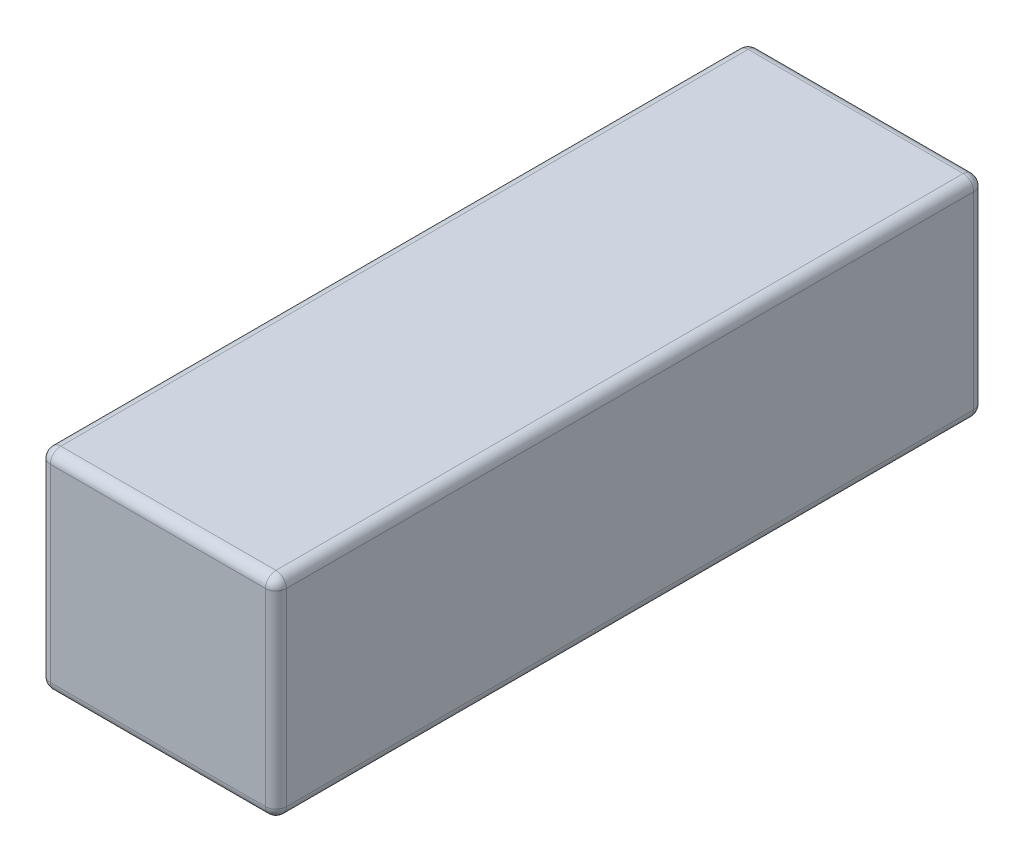
from build123d import *

# Parameters (mm, degrees)
SKETCH1_W           = 45
SKETCH1_H           = 40
BOSS_EXTRUDE1_DEPTH = 135
FILLET1_R           = 2


with BuildPart() as part:
    # Sketch1 → Boss-Extrude1 (new body)
    with BuildSketch(Plane.XY):
        Rectangle(SKETCH1_W, SKETCH1_H)
    extrude(amount=BOSS_EXTRUDE1_DEPTH)

    # Fillet1
    fillet1_edges = [part.edges().sort_by_distance(p)[0] for p in [
        (-22.5, 0, 135),
        (0, -20, 135),
        (22.5, 0, 135),
        (0, -20, 0),
        (-22.5, 0, 0),
        (0, 20, 0),
        (22.5, 0, 0),
        (0, 20, 135),
        (22.5, -20, 67.5),
        (-22.5, -20, 67.5),
        (-22.5, 20, 67.5),
        (22.5, 20, 67.5),
    ]]
    fillet(fillet1_edges, radius=FILLET1_R)


solid = part.part
